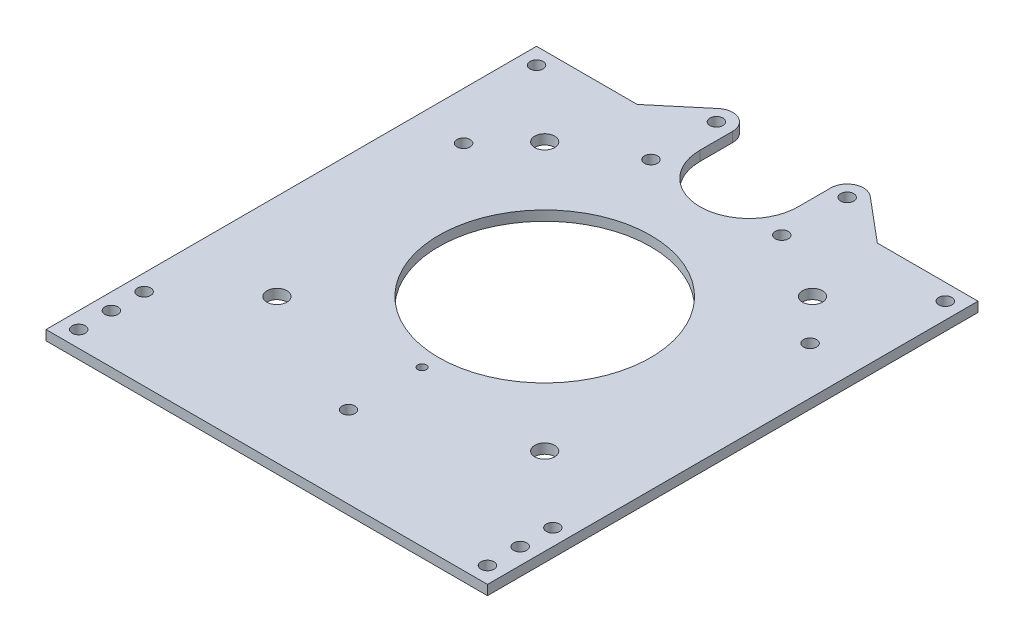
from build123d import *

# Parameters (mm, degrees)
SKETCH_1_R      = 2
SKETCH_1_R_2    = 3.05
SKETCH_1_R_3    = 1.3
SKETCH_1_R_4    = 32.4
EXTRUDE_1_DEPTH = 3


with BuildPart() as part:
    # ｽｹｯﾁ1 → ﾎﾞｽ - 押し出し1 (new body)
    with BuildSketch(Plane(origin=(0, 0, 0), x_dir=(1, 0, 0), z_dir=(0, 1, 0))):
        with BuildLine():
            Line((0, 150), (0, 0))
            Line((0, 0), (135, 0))
            Line((135, 0), (135, 150))
            Line((135, 150), (104.216771079, 150))
            Line((104.216771079, 150), (90.713938048, 161.330222216))
            ThreePointArc((90.713938048, 161.330222216), (85.386908691, 162.031538935), (82.5, 157.5))
            Line((82.5, 157.5), (82.5, 147.5))
            ThreePointArc((82.5, 147.5), (67.5, 132.5), (52.5, 147.5))
            Line((52.5, 147.5), (52.5, 150))
            Line((52.5, 150), (52.5, 157.5))
            ThreePointArc((52.5, 157.5), (49.613091309, 162.031538935), (44.286061952, 161.330222216))
            Line((44.286061952, 161.330222216), (30.783228921, 150))
            Line((30.783228921, 150), (0, 150))
        make_face()
        with Locations(Location((5, 5, 0), (0, 0, 270))):
            Circle(SKETCH_1_R, mode=Mode.SUBTRACT)
        with Locations(Location((5, 15, 0), (0, 0, 270))):
            Circle(SKETCH_1_R, mode=Mode.SUBTRACT)
        with Locations(Location((5, 25, 0), (0, 0, 270))):
            Circle(SKETCH_1_R, mode=Mode.SUBTRACT)
        with Locations(Location((26.558517369, 44.058517369, 0), (0, 0, 270))):
            Circle(SKETCH_1_R_2, mode=Mode.SUBTRACT)
        with Locations(Location((67.5, 25, 0), (0, 0, 270))):
            Circle(SKETCH_1_R, mode=Mode.SUBTRACT)
        with Locations(Location((130, 5, 0), (0, 0, 270))):
            Circle(SKETCH_1_R, mode=Mode.SUBTRACT)
        with Locations(Location((130, 15, 0), (0, 0, 270))):
            Circle(SKETCH_1_R, mode=Mode.SUBTRACT)
        with Locations(Location((130, 25, 0), (0, 0, 270))):
            Circle(SKETCH_1_R, mode=Mode.SUBTRACT)
        with Locations(Location((67.5, 47.5, 0), (0, 0, 270))):
            Circle(SKETCH_1_R_3, mode=Mode.SUBTRACT)
        with Locations(Location((108.441482631, 44.058517369, 0), (0, 0, 270))):
            Circle(SKETCH_1_R_2, mode=Mode.SUBTRACT)
        with Locations(Location((14.523144428, 113.168293767, 0), (0, 0, 270))):
            Circle(SKETCH_1_R, mode=Mode.SUBTRACT)
        with Locations(Location((67.5, 85, 0), (0, 0, 270))):
            Circle(SKETCH_1_R_4, mode=Mode.SUBTRACT)
        with Locations(Location((26.558517369, 125.941482631, 0), (0, 0, 270))):
            Circle(SKETCH_1_R_2, mode=Mode.SUBTRACT)
        with Locations(Location((5, 145, 0), (0, 0, 270))):
            Circle(SKETCH_1_R, mode=Mode.SUBTRACT)
        with Locations(Location((47.5, 137.5, 0), (0, 0, 270))):
            Circle(SKETCH_1_R, mode=Mode.SUBTRACT)
        with Locations(Location((47.5, 157.5, 0), (0, 0, 270))):
            Circle(SKETCH_1_R, mode=Mode.SUBTRACT)
        with Locations(Location((120.476855572, 113.168293767, 0), (0, 0, 270))):
            Circle(SKETCH_1_R, mode=Mode.SUBTRACT)
        with Locations(Location((87.5, 137.5, 0), (0, 0, 270))):
            Circle(SKETCH_1_R, mode=Mode.SUBTRACT)
        with Locations(Location((108.441482631, 125.941482631, 0), (0, 0, 270))):
            Circle(SKETCH_1_R_2, mode=Mode.SUBTRACT)
        with Locations(Location((130, 145, 0), (0, 0, 270))):
            Circle(SKETCH_1_R, mode=Mode.SUBTRACT)
        with Locations(Location((87.5, 157.5, 0), (0, 0, 270))):
            Circle(SKETCH_1_R, mode=Mode.SUBTRACT)
    extrude(amount=EXTRUDE_1_DEPTH)


solid = part.part
